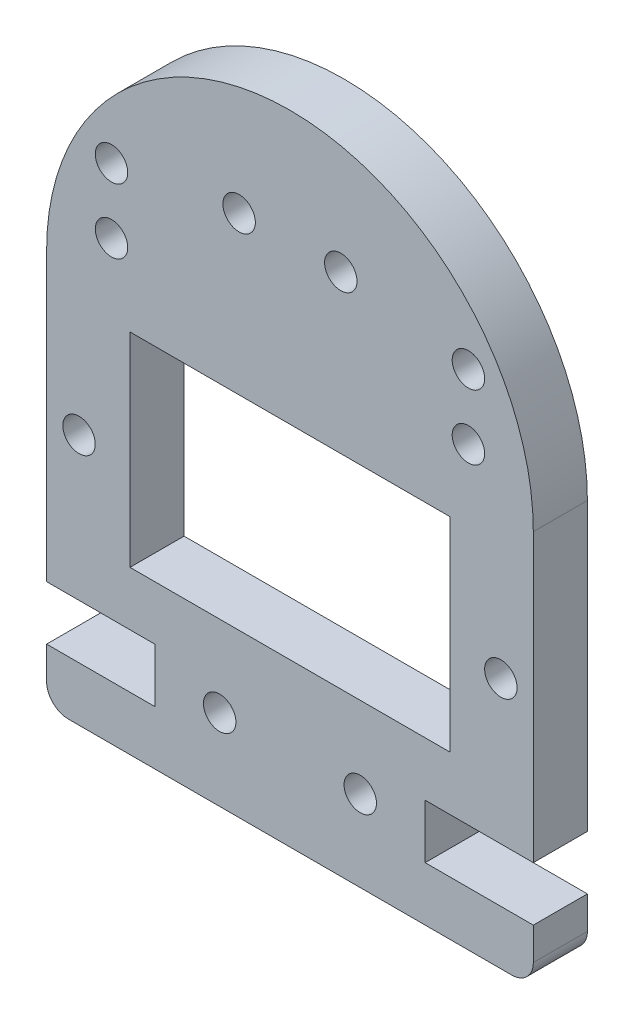
from build123d import *

# Parameters (mm, degrees)
RESSALTO_EXTRUS_O2_DEPTH = 5
ESBO_O9_W                = 29.58
ESBO_O9_H                = 18.85
CORTE_EXTRUS_O1_DEPTH    = 5
ESBO_O10_R               = 1.5
CORTE_EXTRUS_O2_DEPTH    = 5
ESBO_O12_R               = 1.5
CORTE_EXTRUS_O3_DEPTH    = 10
ESBO_O13_R               = 1.5
CORTE_EXTRUS_O4_DEPTH    = 10
ESBO_O14_R               = 1.5
CORTE_EXTRUS_O5_DEPTH    = 76


with BuildPart() as part:
    # Esboço8 → Ressalto-extrusão2 (new body)
    with BuildSketch(Plane.XY):
        with BuildLine():
            Line((-24.266341706, -3.25), (-24.266341706, 13.25))
            ThreePointArc((-24.266341706, 13.25), (-1.766341706, 35.75), (20.733658294, 13.25))
            Line((20.733658294, 13.25), (20.733658294, -3.222268622))
            Line((20.733658294, -3.222268622), (20.733658294, -3.25))
            Line((20.733658294, -3.25), (20.733658294, -13.25))
            Line((20.733658294, -13.25), (10.733658294, -13.25))
            Line((10.733658294, -13.25), (10.733658294, -18.25))
            Line((10.733658294, -18.25), (20.733658294, -18.25))
            Line((20.733658294, -18.25), (20.733658294, -21.25))
            ThreePointArc((20.733658294, -21.25), (20.147871857, -22.664213562), (18.733658294, -23.25))
            Line((18.733658294, -23.25), (-22.266341706, -23.25))
            ThreePointArc((-22.266341706, -23.25), (-23.680555268, -22.664213562), (-24.266341706, -21.25))
            Line((-24.266341706, -21.25), (-24.266341706, -18.25))
            Line((-24.266341706, -18.25), (-14.266341706, -18.25))
            Line((-14.266341706, -18.25), (-14.266341706, -13.25))
            Line((-14.266341706, -13.25), (-24.266341706, -13.25))
            Line((-24.266341706, -13.25), (-24.266341706, -3.25))
        make_face()
    extrude(amount=RESSALTO_EXTRUS_O2_DEPTH)

    # Esboço9 → Corte-extrusão1 (cut)
    with BuildSketch(Plane(origin=(0, 0, 0), x_dir=(-1, 0, 0), z_dir=(0, 0, -1))):
        with Locations((1.766341706, 1.175)):
            Rectangle(ESBO_O9_W, ESBO_O9_H)
    extrude(amount=-CORTE_EXTRUS_O1_DEPTH, mode=Mode.SUBTRACT)

    # Esboço10 → Corte-extrusão2 (cut)
    with BuildSketch(Plane(origin=(0, 0, 0), x_dir=(-1, 0, 0), z_dir=(0, 0, -1))):
        with Locations((-17.733658294, 0)):
            Circle(ESBO_O10_R)
        with Locations((21.266341706, 0)):
            Circle(ESBO_O10_R)
    extrude(amount=-CORTE_EXTRUS_O2_DEPTH, mode=Mode.SUBTRACT)

    # Esboço12 → Corte-extrusão3 (cut)
    with BuildSketch(Plane.XY.offset(5)):
        with Locations((4.733658294, -15.75)):
            Circle(ESBO_O12_R)
        with Locations((-8.266341706, -15.75)):
            Circle(ESBO_O12_R)
    extrude(amount=-CORTE_EXTRUS_O3_DEPTH, mode=Mode.SUBTRACT)

    # Esboço13 → Corte-extrusão4 (cut)
    with BuildSketch(Plane.XY.offset(5)):
        with Locations((2.933658294, 25.15)):
            Circle(ESBO_O13_R)
        with Locations((-6.466341706, 25.15)):
            Circle(ESBO_O13_R)
    extrude(amount=-CORTE_EXTRUS_O4_DEPTH, mode=Mode.SUBTRACT)

    # Esboço14 → Corte-extrusão5 (cut)
    with BuildSketch(Plane.XY.offset(5)):
        with Locations((14.733658294, 17.25)):
            Circle(ESBO_O14_R)
        with Locations((14.733658294, 23.25)):
            Circle(ESBO_O14_R)
        with Locations((-18.266341706, 23.25)):
            Circle(ESBO_O14_R)
        with Locations((-18.266341706, 17.25)):
            Circle(ESBO_O14_R)
    extrude(amount=-CORTE_EXTRUS_O5_DEPTH, mode=Mode.SUBTRACT)


solid = part.part
